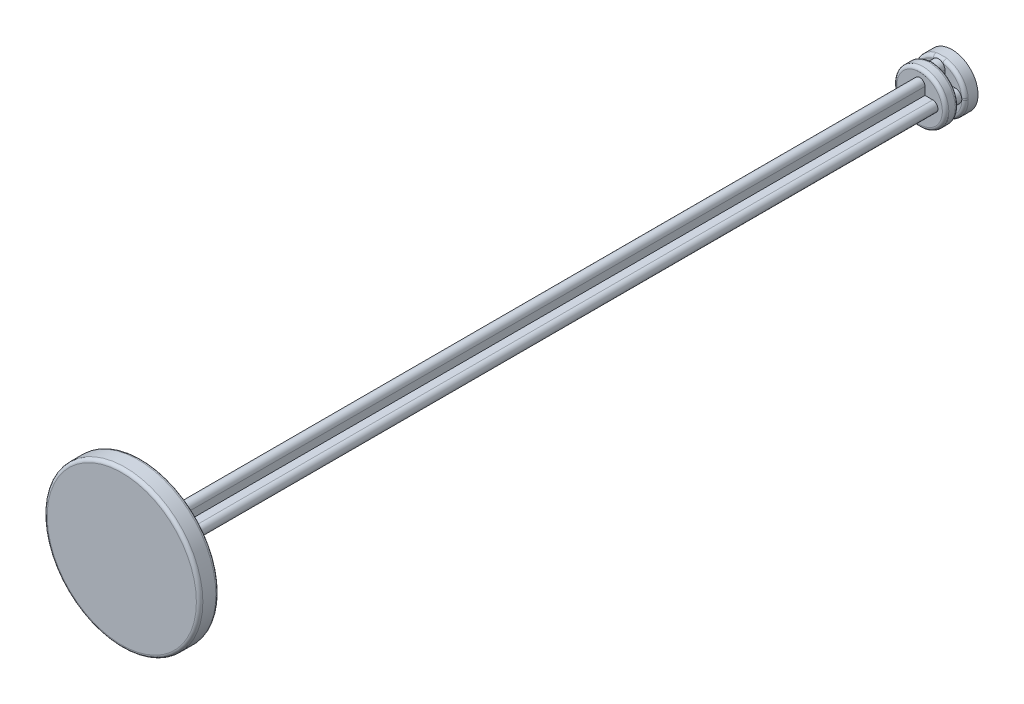
from build123d import *

# Parameters (mm, degrees)
BOSS_EXTRUDE1_DEPTH = 60
SKETCH4_R           = 6
BOSS_EXTRUDE2_DEPTH = 1.5
SKETCH5_R           = 2
BOSS_EXTRUDE3_DEPTH = 1
BOSS_EXTRUDE4_DEPTH = 0.5
SKETCH9_R           = 2
BOSS_EXTRUDE5_DEPTH = 1
DOME1_FACE_RADIUS   = 2
DOME1_HEIGHT        = 0.5
FILLET1_R           = 0.25


with BuildPart() as part:
    # Sketch3 → Boss-Extrude1 (new body)
    with BuildSketch(Plane.XY):
        with BuildLine():
            ThreePointArc((-0.989400555, -0.403387526), (-1.389400555, -0.003387526), (-0.989400555, 0.396612474))
            Line((-0.989400555, 0.396612474), (-0.389400555, 0.396612474))
            Line((-0.389400555, 0.396612474), (-0.389400555, 0.996612474))
            ThreePointArc((-0.389400555, 0.996612474), (0.010599445, 1.396612474), (0.410599445, 0.996612474))
            Line((0.410599445, 0.996612474), (0.410599445, 0.396612474))
            Line((0.410599445, 0.396612474), (1.010599445, 0.396612474))
            ThreePointArc((1.010599445, 0.396612474), (1.410599445, -0.003387526), (1.010599445, -0.403387526))
            Line((1.010599445, -0.403387526), (0.410599445, -0.403387526))
            Line((0.410599445, -0.403387526), (0.410599445, -1.003387526))
            ThreePointArc((0.410599445, -1.003387526), (0.010599445, -1.403387526), (-0.389400555, -1.003387526))
            Line((-0.389400555, -1.003387526), (-0.389400555, -0.403387526))
            Line((-0.389400555, -0.403387526), (-0.989400555, -0.403387526))
        make_face()
    extrude(amount=BOSS_EXTRUDE1_DEPTH)

    # Sketch4 → Boss-Extrude2 (add)
    with BuildSketch(Plane.XY.offset(60)):
        Circle(SKETCH4_R)
    extrude(amount=BOSS_EXTRUDE2_DEPTH)

    # Sketch5 → Boss-Extrude3 (add)
    with BuildSketch(Plane(origin=(0, 0, 0), x_dir=(-1, 0, 0), z_dir=(0, 0, -1))):
        Circle(SKETCH5_R)
    extrude(amount=BOSS_EXTRUDE3_DEPTH)

    # Sketch6 → Boss-Extrude4 (add)
    with BuildSketch(Plane(origin=(0, 0, -1), x_dir=(-1, 0, 0), z_dir=(0, 0, -1))):
        with BuildLine():
            Line((-0.451338334, 0.561736981), (-0.451338334, 1.361736981))
            ThreePointArc((-0.451338334, 1.361736981), (0.048661666, 1.861736981), (0.548661666, 1.361736981))
            Line((0.548661666, 1.361736981), (0.548661666, 0.561736981))
            Line((0.548661666, 0.561736981), (1.348661666, 0.561736981))
            ThreePointArc((1.348661666, 0.561736981), (1.848661666, 0.061736981), (1.348661666, -0.438263019))
            Line((1.348661666, -0.438263019), (0.548661666, -0.438263019))
            Line((0.548661666, -0.438263019), (0.548661666, -1.238263019))
            ThreePointArc((0.548661666, -1.238263019), (0.048661666, -1.738263019), (-0.451338334, -1.238263019))
            Line((-0.451338334, -1.238263019), (-0.451338334, -0.438263019))
            Line((-0.451338334, -0.438263019), (-1.251338334, -0.438263019))
            ThreePointArc((-1.251338334, -0.438263019), (-1.751338334, 0.061736981), (-1.251338334, 0.561736981))
            Line((-1.251338334, 0.561736981), (-0.451338334, 0.561736981))
        make_face()
    extrude(amount=BOSS_EXTRUDE4_DEPTH)

    # Sketch9 → Boss-Extrude5 (add)
    with BuildSketch(Plane(origin=(0, 0, -1.5), x_dir=(-1, 0, 0), z_dir=(0, 0, -1))):
        Circle(SKETCH9_R)
    extrude(amount=BOSS_EXTRUDE5_DEPTH)

    # Dome1: a dome of height H over a round flat face of radius A is a cap of a sphere of radius (A * A + H * H) / (2 * H)
    dome1_r = (DOME1_FACE_RADIUS * DOME1_FACE_RADIUS + DOME1_HEIGHT * DOME1_HEIGHT) / (2 * DOME1_HEIGHT)
    dome1_base = Plane((0, 0, -2.5), z_dir=(0, 0, -1))
    with Locations(dome1_base.offset(DOME1_HEIGHT - dome1_r)):
        dome1_ball = Sphere(dome1_r, mode=Mode.PRIVATE)
    add(split(dome1_ball, bisect_by=dome1_base, keep=Keep.TOP, mode=Mode.PRIVATE))

    # Fillet1
    fillet1_edges = [part.edges().sort_by_distance(p)[0] for p in [
        (-6, 0, 60),
        (-6, 0, 61.5),
        (2, 0, 0),
        (2, 0, -1),
        (2, 0, -1.5),
    ]]
    fillet(fillet1_edges, radius=FILLET1_R)


solid = part.part
